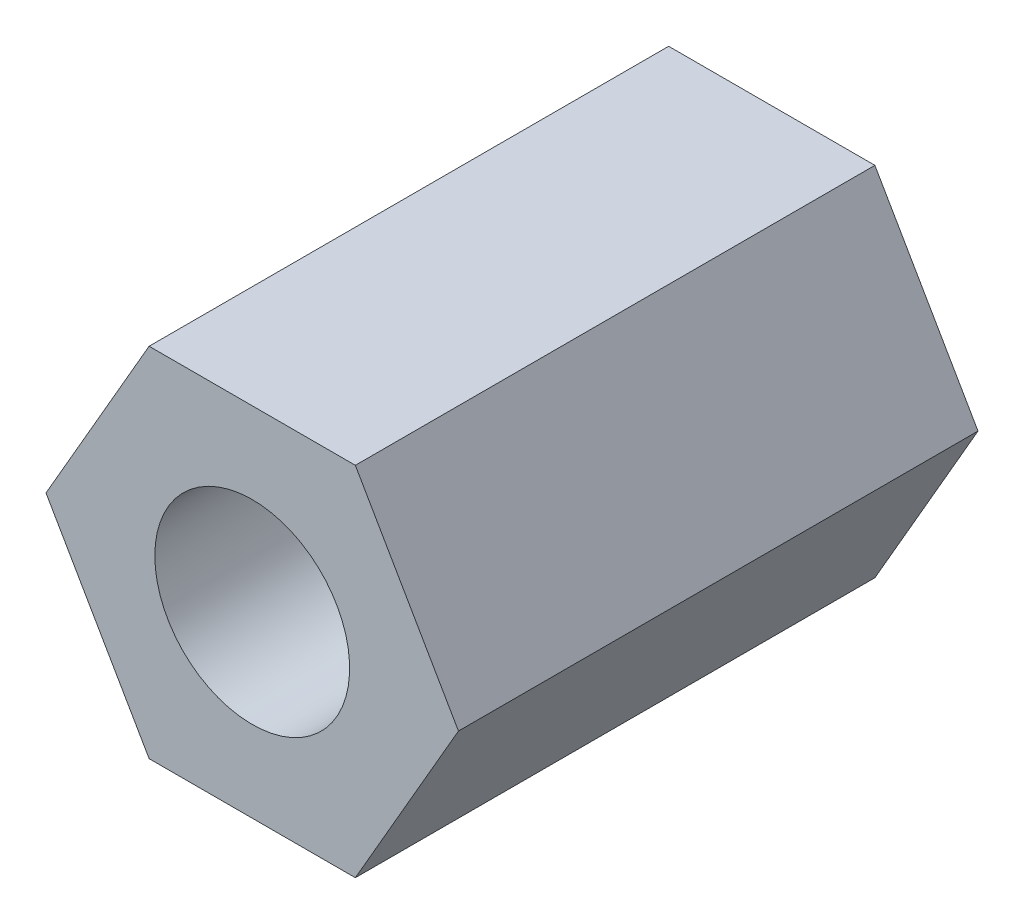
from build123d import *

# Parameters (mm, degrees)
BASE_EXTRUSION_DEPTH    = 8
ESQUISSE3_R             = 1.5
ENL_V_MAT_EXTRU_1_DEPTH = 10.035808394


with BuildPart() as part:
    # Esquisse1 → Base-Extrusion (new body)
    with BuildSketch(Plane.XY):
        Polygon((1.58771324, 2.75), (-1.58771324, 2.75), (-3.175426481, 0), (-1.58771324, -2.75), (1.58771324, -2.75), (3.175426481, 0), align=None)
    extrude(amount=BASE_EXTRUSION_DEPTH)

    # Esquisse3 → Enlèv. mat.-Extru.1 (cut, through all)
    with BuildSketch(Plane(origin=(0, 0, 0), x_dir=(-1, 0, 0), z_dir=(0, 0, -1))):
        Circle(ESQUISSE3_R)
    extrude(amount=-ENL_V_MAT_EXTRU_1_DEPTH, mode=Mode.SUBTRACT)


solid = part.part
